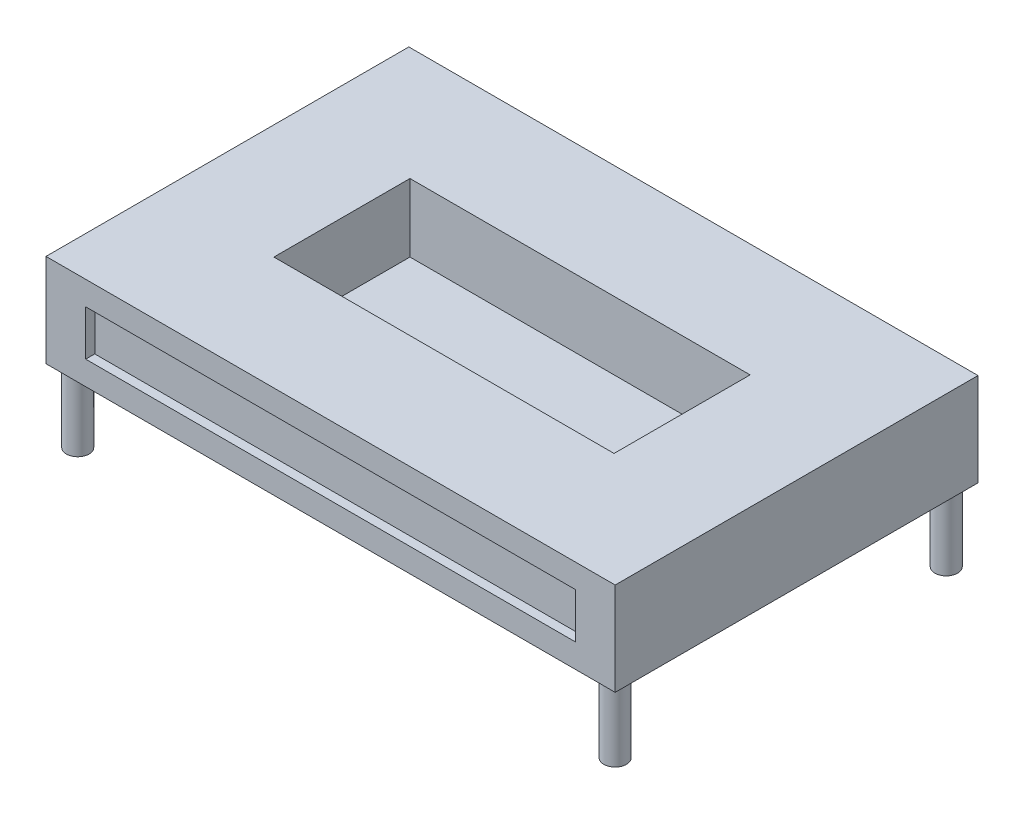
from build123d import *

# Parameters (mm, degrees)
SKETCH_2_W                                 = 125.5
SKETCH_2_H                                 = 80
EXTRUDE_1_DEPTH                            = 10.25
SKETCH_3_W                                 = 75
SKETCH_3_H                                 = 30
CUT_EXTRUDE_1_DEPTH                        = 15
SKETCH_4_R                                 = 2.5
EXTRUDE_2_DEPTH                            = 16
MIRROR_1_AT_THE_SECOND_PLANE_COPY_1_SKET_R = 2.5
MIRROR_1_AT_THE_SECOND_PLANE_COPY_1_DEPTH  = 16
SKETCH_5_W                                 = 108
SKETCH_5_H                                 = 10
CUT_EXTRUDE_2_DEPTH                        = 2


with BuildPart() as part:
    # 草图2 → 凸台-拉伸1 (new, symmetric)
    with BuildSketch(Plane(origin=(0, 0, 0), x_dir=(1, 0, 0), z_dir=(0, 1, 0))):
        Rectangle(SKETCH_2_W, SKETCH_2_H)
    extrude(amount=EXTRUDE_1_DEPTH, both=True)

    # 草图3 → 切除-拉伸1 (cut)
    with BuildSketch(Plane(origin=(0, 10.25, 0), x_dir=(1, 0, 0), z_dir=(0, 1, 0))):
        Rectangle(SKETCH_3_W, SKETCH_3_H)
    extrude(amount=-CUT_EXTRUDE_1_DEPTH, mode=Mode.SUBTRACT)

    # 草图4 → 凸台-拉伸2 (add)
    with BuildSketch(Plane.XZ.offset(10.25)):
        with Locations(Location((59.25, 36.5, 0), (0, 0, 270))):
            Circle(SKETCH_4_R)
    extrude_2 = extrude(amount=EXTRUDE_2_DEPTH)

    # 镜向1: 凸台-拉伸2 across plane
    add(extrude_2.mirror(Plane(origin=(0, 0, 0), x_dir=(0, 0, 1), z_dir=(1, 0, 0))))

    # 镜向1 at the second plane: 凸台-拉伸2 across plane
    add(extrude_2.mirror(Plane.XY))

    # 镜向1 at the second plane copy 1 sket → 镜向1 at the second plane copy 1 (add)
    with BuildSketch(Plane(origin=(0, -10.25, 0), x_dir=(-1, 0, 0), z_dir=(0, -1, 0))):
        with Locations(Location((59.25, 36.5, 0), (0, 0, 270))):
            Circle(MIRROR_1_AT_THE_SECOND_PLANE_COPY_1_SKET_R)
    extrude(amount=MIRROR_1_AT_THE_SECOND_PLANE_COPY_1_DEPTH)

    # 草图5 → 切除-拉伸2 (cut)
    with BuildSketch(Plane.XY.offset(40)):
        Rectangle(SKETCH_5_W, SKETCH_5_H)
    cut_extrude_2 = extrude(amount=-CUT_EXTRUDE_2_DEPTH, mode=Mode.SUBTRACT)

    # 镜向2: 切除-拉伸2 across plane
    add(cut_extrude_2.mirror(Plane.XY), mode=Mode.SUBTRACT)


solid = part.part
